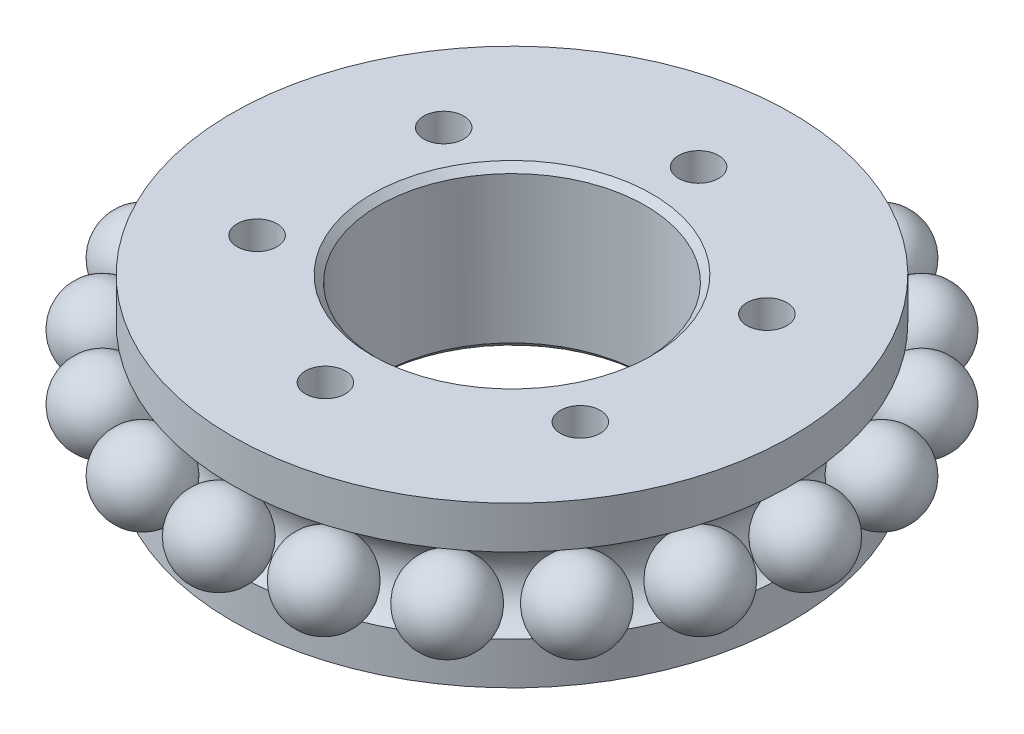
from build123d import *

# Parameters (mm, degrees)
PATTERN_CIRCULAR_4_COUNT = 20
SKETCH_3_R               = 1.5
CUT_EXTRUDE_1_DEPTH      = 20
CHAMFER_1_SIZE           = 0.5


with BuildPart() as part:
    # 草图1 → 旋转1 (revolve)
    with BuildSketch(Plane.XY, mode=Mode.PRIVATE) as revolve_1_sk:
        with BuildLine():
            Line((-10, -6), (-10, 6))
            Line((-10, 6), (-21, 6))
            Line((-21, 6), (-21, 2.828427125))
            ThreePointArc((-21, 2.828427125), (-19, 0), (-21, -2.828427125))
            Line((-21, -2.828427125), (-21, -6))
            Line((-21, -6), (-10, -6))
        make_face()
    revolve(revolve_1_sk.sketch.rotate(Axis((0, 41.099126448, 0), (0, -1, 0)), 270), axis=Axis((0, 41.099126448, 0), (0, -1, 0)))

    # 草图3 → 切除-拉伸1 (cut)
    with BuildSketch(Plane(origin=(0, 6, 0), x_dir=(1, 0, 0), z_dir=(0, 1, 0))):
        with Locations(Location((0, 14, 0), (0, 0, 270))):
            Circle(SKETCH_3_R)
        with Locations(Location((12.124355653, 7, 0), (0, 0, 270))):
            Circle(SKETCH_3_R)
        with Locations(Location((12.124355653, -7, 0), (0, 0, 270))):
            Circle(SKETCH_3_R)
        with Locations(Location((0, -14, 0), (0, 0, 270))):
            Circle(SKETCH_3_R)
        with Locations(Location((-12.124355653, -7, 0), (0, 0, 270))):
            Circle(SKETCH_3_R)
        with Locations(Location((-12.124355653, 7, 0), (0, 0, 270))):
            Circle(SKETCH_3_R)
    extrude(amount=-CUT_EXTRUDE_1_DEPTH, mode=Mode.SUBTRACT)

    # 倒角1
    chamfer_1_edges = [part.edges().sort_by_distance(p)[0] for p in [
        (0, -6, -10),
        (0, 6, -10),
    ]]
    chamfer(chamfer_1_edges, length=CHAMFER_1_SIZE)


with BuildPart() as body_2:
    # 草图2 → 旋转4 (revolve)
    with BuildSketch(Plane(origin=(0, 0, 0), x_dir=(0, 0, -1), z_dir=(1, 0, 0))):
        with BuildLine():
            Line((-22, 3), (-22, -3))
            ThreePointArc((-22, -3), (-19, 0), (-22, 3))
        make_face()
    revolve(axis=Axis((0, 3, 22), (0, -1, 0)))


with BuildPart() as pattern_circular_4_1:
    # 阵列(圆周)4: pattern copy
    add(body_2.part.rotate(Axis((0, 0, 0), (0, 1, 0)), 1 * 360 / PATTERN_CIRCULAR_4_COUNT))


with BuildPart() as pattern_circular_4_2:
    # 阵列(圆周)4: pattern copy
    add(body_2.part.rotate(Axis((0, 0, 0), (0, 1, 0)), 2 * 360 / PATTERN_CIRCULAR_4_COUNT))


with BuildPart() as pattern_circular_4_3:
    # 阵列(圆周)4: pattern copy
    add(body_2.part.rotate(Axis((0, 0, 0), (0, 1, 0)), 3 * 360 / PATTERN_CIRCULAR_4_COUNT))


with BuildPart() as pattern_circular_4_4:
    # 阵列(圆周)4: pattern copy
    add(body_2.part.rotate(Axis((0, 0, 0), (0, 1, 0)), 4 * 360 / PATTERN_CIRCULAR_4_COUNT))


with BuildPart() as pattern_circular_4_5:
    # 阵列(圆周)4: pattern copy
    add(body_2.part.rotate(Axis((0, 0, 0), (0, 1, 0)), 5 * 360 / PATTERN_CIRCULAR_4_COUNT))


with BuildPart() as pattern_circular_4_6:
    # 阵列(圆周)4: pattern copy
    add(body_2.part.rotate(Axis((0, 0, 0), (0, 1, 0)), 6 * 360 / PATTERN_CIRCULAR_4_COUNT))


with BuildPart() as pattern_circular_4_7:
    # 阵列(圆周)4: pattern copy
    add(body_2.part.rotate(Axis((0, 0, 0), (0, 1, 0)), 7 * 360 / PATTERN_CIRCULAR_4_COUNT))


with BuildPart() as pattern_circular_4_8:
    # 阵列(圆周)4: pattern copy
    add(body_2.part.rotate(Axis((0, 0, 0), (0, 1, 0)), 8 * 360 / PATTERN_CIRCULAR_4_COUNT))


with BuildPart() as pattern_circular_4_9:
    # 阵列(圆周)4: pattern copy
    add(body_2.part.rotate(Axis((0, 0, 0), (0, 1, 0)), 9 * 360 / PATTERN_CIRCULAR_4_COUNT))


with BuildPart() as pattern_circular_4_10:
    # 阵列(圆周)4: pattern copy
    add(body_2.part.rotate(Axis((0, 0, 0), (0, 1, 0)), 10 * 360 / PATTERN_CIRCULAR_4_COUNT))


with BuildPart() as pattern_circular_4_11:
    # 阵列(圆周)4: pattern copy
    add(body_2.part.rotate(Axis((0, 0, 0), (0, 1, 0)), 11 * 360 / PATTERN_CIRCULAR_4_COUNT))


with BuildPart() as pattern_circular_4_12:
    # 阵列(圆周)4: pattern copy
    add(body_2.part.rotate(Axis((0, 0, 0), (0, 1, 0)), 12 * 360 / PATTERN_CIRCULAR_4_COUNT))


with BuildPart() as pattern_circular_4_13:
    # 阵列(圆周)4: pattern copy
    add(body_2.part.rotate(Axis((0, 0, 0), (0, 1, 0)), 13 * 360 / PATTERN_CIRCULAR_4_COUNT))


with BuildPart() as pattern_circular_4_14:
    # 阵列(圆周)4: pattern copy
    add(body_2.part.rotate(Axis((0, 0, 0), (0, 1, 0)), 14 * 360 / PATTERN_CIRCULAR_4_COUNT))


with BuildPart() as pattern_circular_4_15:
    # 阵列(圆周)4: pattern copy
    add(body_2.part.rotate(Axis((0, 0, 0), (0, 1, 0)), 15 * 360 / PATTERN_CIRCULAR_4_COUNT))


with BuildPart() as pattern_circular_4_16:
    # 阵列(圆周)4: pattern copy
    add(body_2.part.rotate(Axis((0, 0, 0), (0, 1, 0)), 16 * 360 / PATTERN_CIRCULAR_4_COUNT))


with BuildPart() as pattern_circular_4_17:
    # 阵列(圆周)4: pattern copy
    add(body_2.part.rotate(Axis((0, 0, 0), (0, 1, 0)), 17 * 360 / PATTERN_CIRCULAR_4_COUNT))


with BuildPart() as pattern_circular_4_18:
    # 阵列(圆周)4: pattern copy
    add(body_2.part.rotate(Axis((0, 0, 0), (0, 1, 0)), 18 * 360 / PATTERN_CIRCULAR_4_COUNT))


with BuildPart() as pattern_circular_4_19:
    # 阵列(圆周)4: pattern copy
    add(body_2.part.rotate(Axis((0, 0, 0), (0, 1, 0)), 19 * 360 / PATTERN_CIRCULAR_4_COUNT))


solid = Compound([part.part, body_2.part, pattern_circular_4_1.part, pattern_circular_4_2.part, pattern_circular_4_3.part, pattern_circular_4_4.part, pattern_circular_4_5.part, pattern_circular_4_6.part, pattern_circular_4_7.part, pattern_circular_4_8.part, pattern_circular_4_9.part, pattern_circular_4_10.part, pattern_circular_4_11.part, pattern_circular_4_12.part, pattern_circular_4_13.part, pattern_circular_4_14.part, pattern_circular_4_15.part, pattern_circular_4_16.part, pattern_circular_4_17.part, pattern_circular_4_18.part, pattern_circular_4_19.part])
